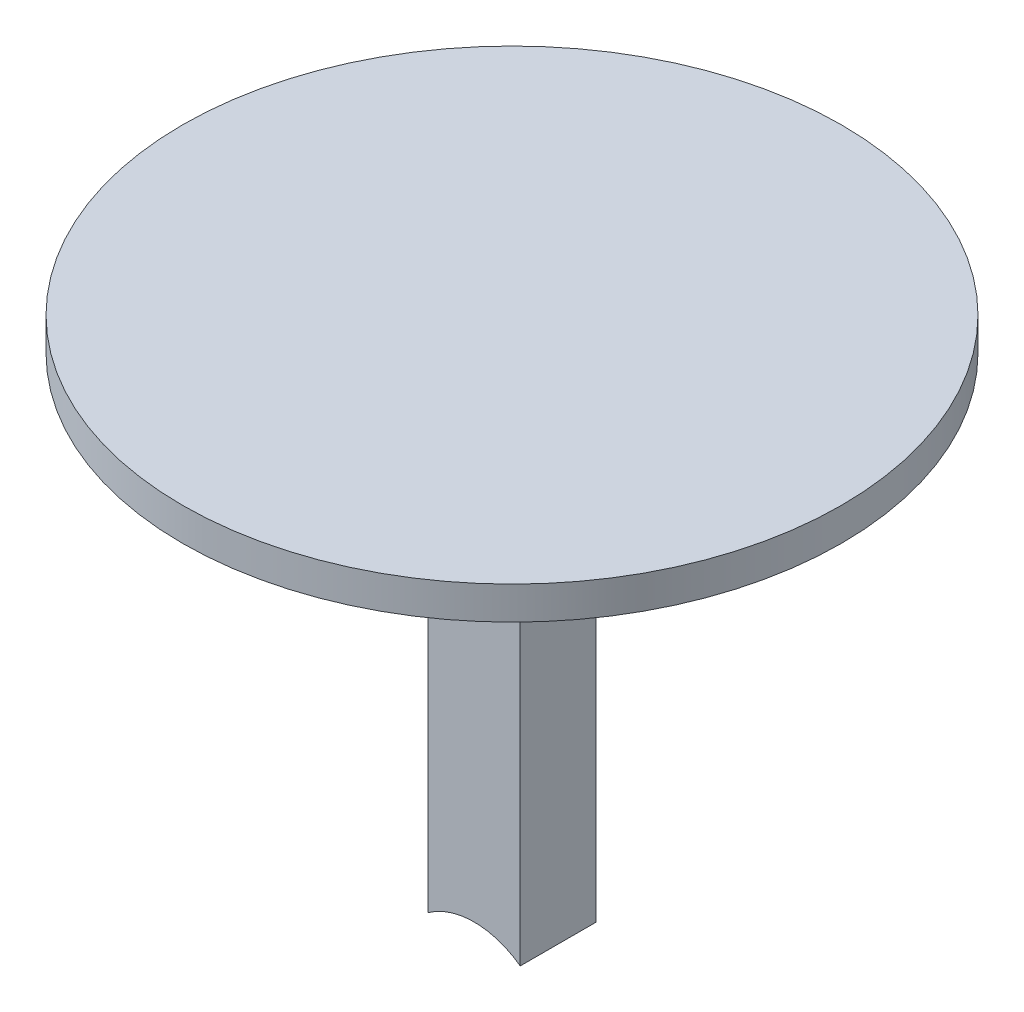
from build123d import *

# Parameters (mm, degrees)
SKETCH_1_W          = 11.2
SKETCH_1_H          = 9.2
EXTRUDE_1_DEPTH     = 60
SKETCH_1_12_W       = 5.2
SKETCH_1_12_H       = 3.2
CUT_EXTRUDE_1_DEPTH = 18
SKETCH_2_R          = 9.5
CUT_EXTRUDE_2_DEPTH = 61.959002617
FILLET_1_R          = 2
SKETCH_3_R          = 40
EXTRUDE_2_DEPTH     = 4
EXTRUDE_3_DEPTH     = 1.5
EXTRUDE_4_DEPTH     = 1.5
FILLET_2_R          = 10


with BuildPart() as part:
    # 草图1 → 凸台-拉伸1 (new body)
    with BuildSketch(Plane(origin=(0, 0, 0), x_dir=(1, 0, 0), z_dir=(0, 1, 0))):
        Rectangle(SKETCH_1_W, SKETCH_1_H)
    extrude(amount=EXTRUDE_1_DEPTH)

    # 草图1<12> → 切除-拉伸1 (cut)
    with BuildSketch(Plane(origin=(0, 0, 0), x_dir=(1, 0, 0), z_dir=(0, 1, 0))):
        Rectangle(SKETCH_1_12_W, SKETCH_1_12_H)
    extrude(amount=CUT_EXTRUDE_1_DEPTH, mode=Mode.SUBTRACT)

    # 草图2 → 切除-拉伸2 (cut, through all)
    with BuildSketch(Plane(origin=(0, 0, -4.6), x_dir=(-1, 0, 0), z_dir=(0, 0, -1))):
        with Locations((0, -7)):
            Circle(SKETCH_2_R)
    extrude(amount=-CUT_EXTRUDE_2_DEPTH, mode=Mode.SUBTRACT)

    # 圆角1
    fillet_1_edges = [part.edges().sort_by_distance(p)[0] for p in [
        (0, 2.5, -1.6),
        (-2.6, 2.137286249, 0),
        (2.6, 2.137286249, 0),
        (0, 2.5, 1.6),
    ]]
    fillet(fillet_1_edges, radius=FILLET_1_R)

    # 草图3 → 凸台-拉伸2 (add)
    with BuildSketch(Plane(origin=(0, 60, 0), x_dir=(1, 0, 0), z_dir=(0, 1, 0))):
        Circle(SKETCH_3_R)
    extrude(amount=EXTRUDE_2_DEPTH)

    # 草图4 → 凸台-拉伸3 (add, symmetric)
    with BuildSketch(Plane.ZY):
        with BuildLine():
            ThreePointArc((-20.1, 60), (-19.591568767, 58.488823688), (-18.273076923, 57.592310764))
            Line((-18.273076923, 57.592310764), (-9.847432928, 55.236896099))
            Line((-9.847432928, 55.236896099), (-7.061421083, 39.5625))
            ThreePointArc((-7.061421083, 39.5625), (-6.205654072, 38.083786285), (-4.6, 37.5))
            Line((-4.6, 37.5), (-4.6, 60))
            Line((-4.6, 60), (-20.1, 60))
        make_face()
    extrude_3 = extrude(amount=EXTRUDE_3_DEPTH, both=True)

    # 草图5 → 凸台-拉伸4 (add, symmetric)
    with BuildSketch(Plane.XY):
        with BuildLine():
            ThreePointArc((-23.6, 60), (-23.057203403, 58.444572458), (-21.664516129, 57.564569537))
            Line((-21.664516129, 57.564569537), (-10.81412887, 55.04952396))
            Line((-10.81412887, 55.04952396), (-8.061421083, 39.5625))
            ThreePointArc((-8.061421083, 39.5625), (-7.205654072, 38.083786285), (-5.6, 37.5))
            Line((-5.6, 37.5), (-5.6, 60))
            Line((-5.6, 60), (-23.6, 60))
        make_face()
    extrude_4 = extrude(amount=EXTRUDE_4_DEPTH, both=True)

    # 镜向2: 凸台-拉伸3 across plane
    add(extrude_3.mirror(Plane.XY))

    # 镜向3: 凸台-拉伸4 across plane
    add(extrude_4.mirror(Plane(origin=(0, 0, 0), x_dir=(0, 0, 1), z_dir=(1, 0, 0))))

    # 圆角2
    fillet_2_edges = [part.edges().sort_by_distance(p)[0] for p in [
        (0, 55.236896099, -9.847432928),
        (0, 55.236896099, 9.847432928),
        (10.81412887, 55.04952396, 0),
        (-10.81412887, 55.04952396, 0),
    ]]
    fillet(fillet_2_edges, radius=FILLET_2_R)


solid = part.part
